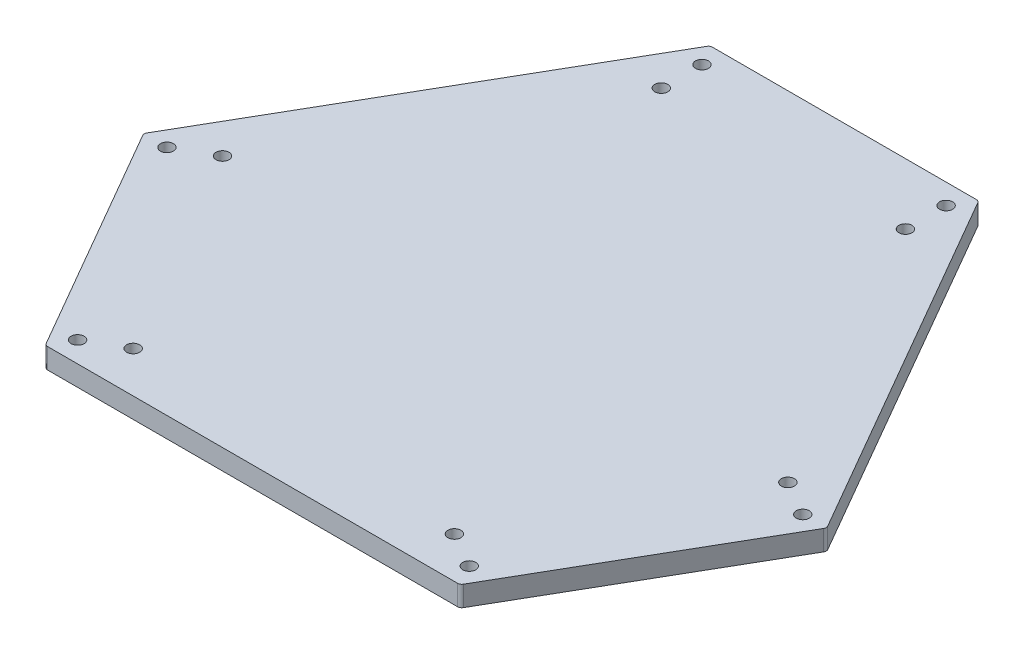
from build123d import *

# Parameters (mm, degrees)
EXTRUDE_1_DEPTH          = 2.5
FILLET_1_R               = 1
SKETCH_3_R               = 1.6
CUT_EXTRUDE_1_DEPTH      = 115.530801874
PATTERN_CIRCULAR_1_COUNT = 3


with BuildPart() as part:
    # ｽｹｯﾁ2 → ﾎﾞｽ - 押し出し1 (new, symmetric)
    with BuildSketch(Plane(origin=(0, 0, 0), x_dir=(1, 0, 0), z_dir=(0, 1, 0))):
        Polygon((-83.963378955, -10.371161675), (-50.963378955, -67.528838325), (50.963378955, -67.528838325), (83.963378955, -10.371161675), (33, 77.9), (-33, 77.9), align=None)
    extrude(amount=EXTRUDE_1_DEPTH, both=True)

    # ﾌｨﾚｯﾄ1
    fillet_1_edges = [part.edges().sort_by_distance(p)[0] for p in [
        (-33, 0, -77.9),
        (33, 0, -77.9),
        (83.963378955, 0, 10.371161675),
        (50.963378955, 0, 67.528838325),
        (-83.963378955, 0, 10.371161675),
        (-50.963378955, 0, 67.528838325),
    ]]
    fillet(fillet_1_edges, radius=FILLET_1_R)

    # ｽｹｯﾁ3 → ｶｯﾄ - 押し出し1 (cut, symmetric)
    with BuildSketch(Plane(origin=(0, 2.5, 0), x_dir=(1, 0, 0), z_dir=(0, 1, 0))):
        with Locations((-30, 72.9)):
            Circle(SKETCH_3_R)
        with Locations((-30, 62.9)):
            Circle(SKETCH_3_R)
        with Locations((30, 62.9)):
            Circle(SKETCH_3_R)
        with Locations((30, 72.9)):
            Circle(SKETCH_3_R)
    cut_extrude_1 = extrude(amount=CUT_EXTRUDE_1_DEPTH, both=True, mode=Mode.SUBTRACT)

    # 円形ﾊﾟﾀｰﾝ1: ｶｯﾄ - 押し出し1 ×3 about axis
    pattern_circular_1_axis = Axis((0, 2.75, 0), (0, -1, 0))
    for i in range(1, PATTERN_CIRCULAR_1_COUNT):
        add(cut_extrude_1.rotate(pattern_circular_1_axis, i * 360 / PATTERN_CIRCULAR_1_COUNT), mode=Mode.SUBTRACT)


solid = part.part
